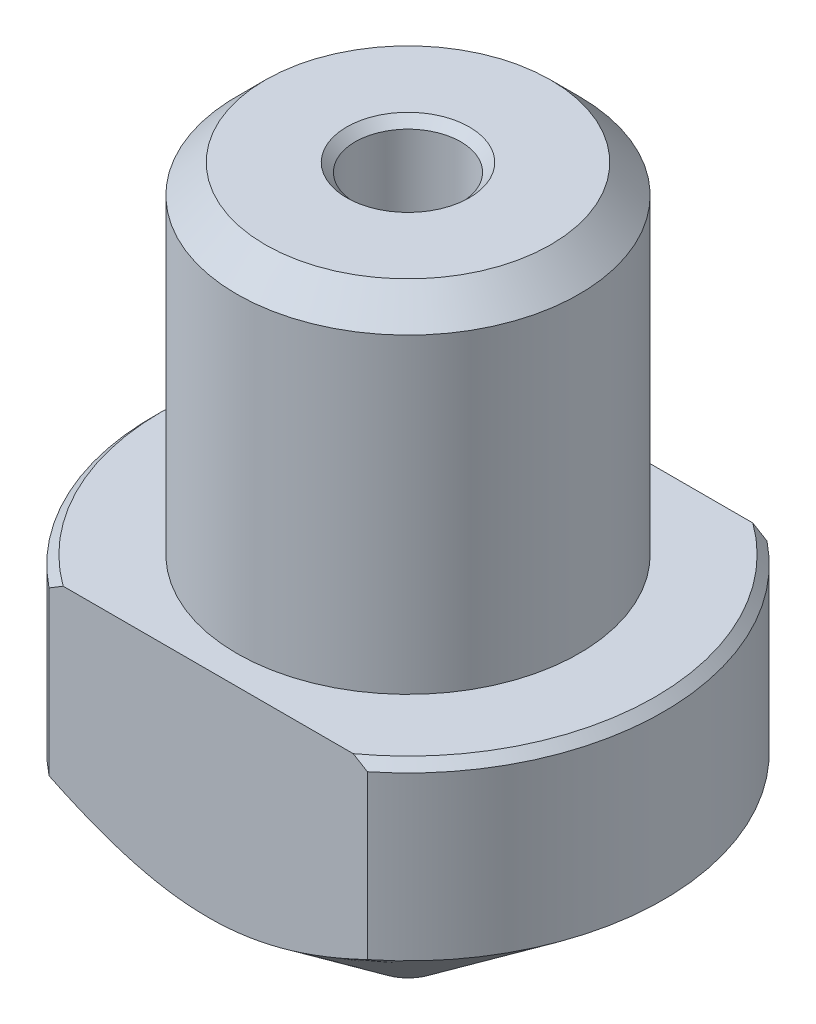
from build123d import *

# Parameters (mm, degrees)
CUT_EXTRUDE1_REACH = 10.721
SKETCH2_W          = 5.576961538
SKETCH2_H          = 0.975
CHAMFER1_SIZE      = 0.5
CHAMFER2_SIZE      = 0.15


with BuildPart() as part:
    # Sketch1 → Revolve1 (revolve)
    with BuildSketch(Plane(origin=(0, 0, 0), x_dir=(0, 0, -1), z_dir=(1, 0, 0)), mode=Mode.PRIVATE) as revolve1_sk:
        Polygon((0.925, -4.438709677), (0.925, 5.95), (3, 5.95), (3, 0), (4.475, 0), (4.475, -3), (0.6, -6), (0.2, -6), (0.2, -5), align=None)
    revolve(revolve1_sk.sketch.rotate(Axis((0, 16.051202931, 0), (0, -1, 0)), 180), axis=Axis((0, 16.051202931, 0), (0, -1, 0)))

    # Cut-Extrude1: up to this cone (the profile starts inside it)
    cut_extrude1_end = Plane(origin=(0, 0, 0), z_dir=(0, 1, 0)).offset(-6.464515129) * Cone(1.292e-06, 33.629208333, 26.035515129, align=(Align.CENTER, Align.CENTER, Align.MIN), mode=Mode.PRIVATE)
    # Sketch2 → Cut-Extrude1 (cut, up to the surface)
    with BuildSketch(Plane(origin=(0, 0, 0), x_dir=(1, 0, 0), z_dir=(0, 1, 0)), mode=Mode.PRIVATE) as cut_extrude1_sk1:
        with Locations((0, -3.9875)):
            Rectangle(SKETCH2_W, SKETCH2_H)
    cut_extrude1_tool1 = extrude(cut_extrude1_sk1.sketch, amount=-CUT_EXTRUDE1_REACH, mode=Mode.PRIVATE) & cut_extrude1_end
    add(cut_extrude1_tool1.solids().sort_by_distance((0, 0, 3.9875))[0], mode=Mode.SUBTRACT)
    # Sketch2 → Cut-Extrude1 (cut, up to the surface)
    with BuildSketch(Plane(origin=(0, 0, 0), x_dir=(1, 0, 0), z_dir=(0, 1, 0)), mode=Mode.PRIVATE) as cut_extrude1_sk2:
        with Locations((0, 3.9875)):
            Rectangle(SKETCH2_W, SKETCH2_H)
    cut_extrude1_tool2 = extrude(cut_extrude1_sk2.sketch, amount=-CUT_EXTRUDE1_REACH, mode=Mode.PRIVATE) & cut_extrude1_end
    add(cut_extrude1_tool2.solids().sort_by_distance((0, 0, -3.9875))[0], mode=Mode.SUBTRACT)

    # Chamfer1
    chamfer1_edges = [part.edges().sort_by_distance(p)[0] for p in [
        (0, 5.95, -3),
    ]]
    chamfer(chamfer1_edges, length=CHAMFER1_SIZE)

    # Chamfer2
    chamfer2_edges = [part.edges().sort_by_distance(p)[0] for p in [
        (-4.475, 0, 0),
        (4.475, 0, 0),
        (0, 5.95, -0.925),
    ]]
    chamfer(chamfer2_edges, length=CHAMFER2_SIZE)


solid = part.part
